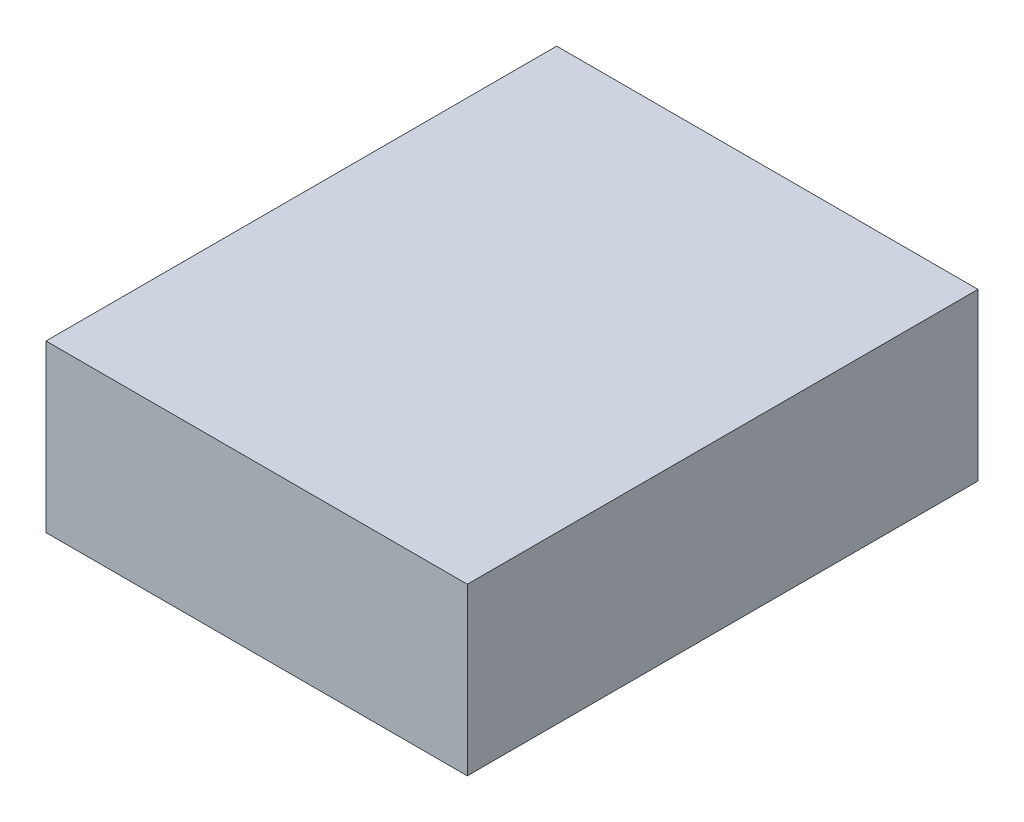
from build123d import *

# Parameters (mm, degrees)
ESQUISSE1_W        = 6.6
ESQUISSE1_H        = 2.6
BOSS_EXTRU_1_DEPTH = 8


with BuildPart() as part:
    # Esquisse1 → Boss.-Extru.1 (new body)
    with BuildSketch(Plane.XY):
        Rectangle(ESQUISSE1_W, ESQUISSE1_H)
    extrude(amount=BOSS_EXTRU_1_DEPTH)


solid = part.part
